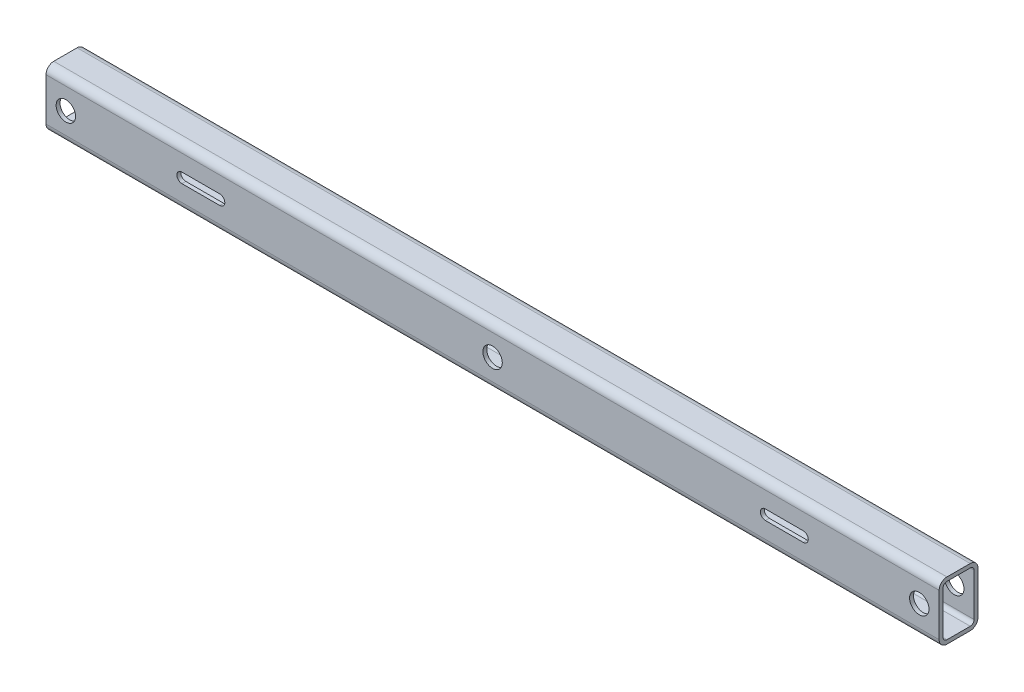
from build123d import *

# Parameters (mm, degrees)
SKETCH1_W           = 2300
SKETCH1_H           = 150
BOSS_EXTRUDE1_DEPTH = 100
SKETCH2_W           = 80
SKETCH2_H           = 130
CUT_EXTRUDE1_DEPTH  = 2304.394234602
FILLET1_R           = 10
FILLET2_R           = 20
SKETCH3_R           = 25
CUT_EXTRUDE2_DEPTH  = 1157.773530126
CUT_EXTRUDE3_DEPTH  = 1157.773530126


with BuildPart() as part:
    # Sketch1 → Boss-Extrude1 (new body)
    with BuildSketch(Plane.XY):
        Rectangle(SKETCH1_W, SKETCH1_H)
    extrude(amount=BOSS_EXTRUDE1_DEPTH)

    # Sketch2 → Cut-Extrude1 (cut, through all)
    with BuildSketch(Plane(origin=(1150, 0, 0), x_dir=(0, 0, -1), z_dir=(1, 0, 0))):
        with Locations((-50, 0)):
            Rectangle(SKETCH2_W, SKETCH2_H)
    extrude(amount=-CUT_EXTRUDE1_DEPTH, mode=Mode.SUBTRACT)

    # Fillet1
    fillet1_edges = [part.edges().sort_by_distance(p)[0] for p in [
        (0, 65, 90),
        (0, 65, 10),
        (0, -65, 10),
        (0, -65, 90),
    ]]
    fillet(fillet1_edges, radius=FILLET1_R)

    # Fillet2
    fillet2_edges = [part.edges().sort_by_distance(p)[0] for p in [
        (0, -75, 100),
        (0, -75, 0),
        (0, 75, 0),
        (0, 75, 100),
    ]]
    fillet(fillet2_edges, radius=FILLET2_R)

    # Sketch3 → Cut-Extrude2 (cut, through all)
    with BuildSketch(Plane(origin=(0, 0, 0), x_dir=(-1, 0, 0), z_dir=(0, 0, -1))):
        Circle(SKETCH3_R)
        with Locations((-1098.86, 0)):
            Circle(SKETCH3_R)
        with Locations((1098.86, 0)):
            Circle(SKETCH3_R)
    extrude(amount=-CUT_EXTRUDE2_DEPTH, mode=Mode.SUBTRACT)

    # Sketch4 → Cut-Extrude3 (cut, through all)
    with BuildSketch(Plane(origin=(0, 0, 0), x_dir=(-1, 0, 0), z_dir=(0, 0, -1))):
        with BuildLine():
            Line((-799.995, 12.91), (-702.465, 12.91))
            ThreePointArc((-702.465, 12.91), (-689.555, 0), (-702.465, -12.91))
            Line((-702.465, -12.91), (-799.995, -12.91))
            ThreePointArc((-799.995, -12.91), (-812.905, 0), (-799.995, 12.91))
        make_face()
        with BuildLine():
            Line((799.995, 12.91), (702.465, 12.91))
            ThreePointArc((702.465, 12.91), (689.555, 0), (702.465, -12.91))
            Line((702.465, -12.91), (799.995, -12.91))
            ThreePointArc((799.995, -12.91), (812.905, 0), (799.995, 12.91))
        make_face()
    extrude(amount=-CUT_EXTRUDE3_DEPTH, mode=Mode.SUBTRACT)


solid = part.part
